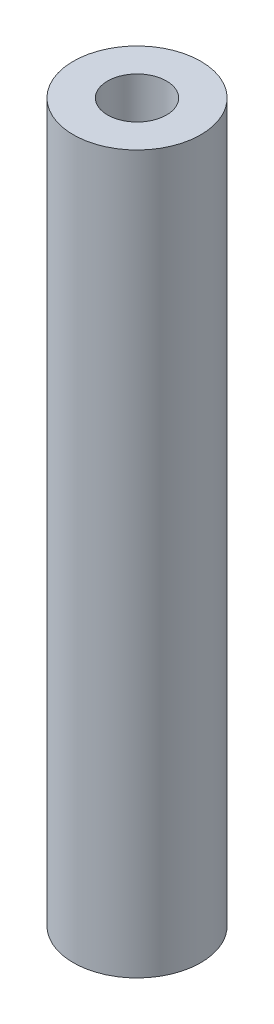
from build123d import *

# Parameters (mm, degrees)
SKETCH_1_R      = 4
SKETCH_1_R_2    = 1.85
EXTRUDE_1_DEPTH = 45


with BuildPart() as part:
    # 草图1 → 凸台-拉伸1 (new body)
    with BuildSketch(Plane(origin=(0, 0, 0), x_dir=(1, 0, 0), z_dir=(0, 1, 0))):
        with Locations(Location((0, 0, 0), (0, 0, 90))):
            Circle(SKETCH_1_R)
        with Locations(Location((0, 0, 0), (0, 0, 90))):
            Circle(SKETCH_1_R_2, mode=Mode.SUBTRACT)
    extrude(amount=EXTRUDE_1_DEPTH)


solid = part.part
